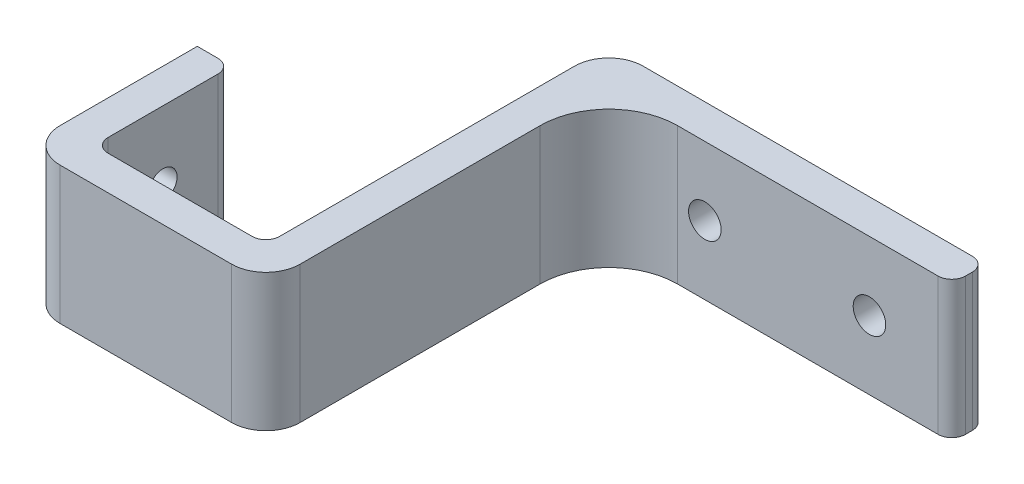
from build123d import *

# Parameters (mm, degrees)
BOSS_EXTRUDE1_DEPTH = 20
SKETCH2_R           = 2.05
CUT_EXTRUDE1_DEPTH  = 88.749643874
SKETCH3_R           = 2.375
CUT_EXTRUDE2_DEPTH  = 100.121138008
FILLET1_R           = 10
FILLET2_R           = 5
FILLET3_R           = 2


with BuildPart() as part:
    # Sketch1 → Boss-Extrude1 (new body)
    with BuildSketch(Plane(origin=(0, 0, 0), x_dir=(1, 0, 0), z_dir=(0, 1, 0))):
        Polygon((0, 0), (-5, 0), (-5, -25), (30, -25), (30, -0.579896907), (30, 25), (80, 25), (80, 30), (25, 30), (25, -20), (0, -20), align=None)
    extrude(amount=BOSS_EXTRUDE1_DEPTH)

    # Sketch2 → Cut-Extrude1 (cut, through all)
    with BuildSketch(Plane(origin=(0, 0, 0), x_dir=(0, 0, -1), z_dir=(1, 0, 0))):
        with Locations((-10, 10)):
            Circle(SKETCH2_R)
    extrude(amount=-CUT_EXTRUDE1_DEPTH, mode=Mode.SUBTRACT)

    # Sketch3 → Cut-Extrude2 (cut, through all)
    with BuildSketch(Plane(origin=(0, 0, -30), x_dir=(-1, 0, 0), z_dir=(0, 0, -1))):
        with Locations((-68, 10)):
            Circle(SKETCH3_R)
        with Locations((-44, 10)):
            Circle(SKETCH3_R)
    extrude(amount=-CUT_EXTRUDE2_DEPTH, mode=Mode.SUBTRACT)

    # Fillet1
    fillet1_edges = [part.edges().sort_by_distance(p)[0] for p in [
        (30, 10, -25),
    ]]
    fillet(fillet1_edges, radius=FILLET1_R)

    # Fillet2
    fillet2_edges = [part.edges().sort_by_distance(p)[0] for p in [
        (25, 10, -30),
        (30, 10, 25),
        (-5, 10, 25),
    ]]
    fillet(fillet2_edges, radius=FILLET2_R)

    # Fillet3
    fillet3_edges = [part.edges().sort_by_distance(p)[0] for p in [
        (0, 10, 20),
        (25, 10, 20),
        (80, 10, -30),
        (80, 10, -25),
        (0, 10, 0),
    ]]
    fillet(fillet3_edges, radius=FILLET3_R)


solid = part.part
